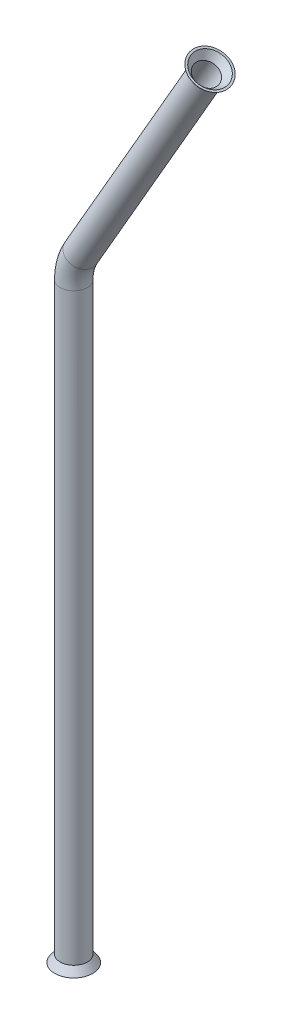
from build123d import *

# Parameters (mm, degrees)
SKETCH1_R           = 4.826
SKETCH1_R_2         = 4.064
SKETCH3_R           = 4.826
BOSS_EXTRUDE1_DEPTH = 2.54
BOSS_EXTRUDE1_DRAFT = -37
SKETCH5_R           = 4.826
BOSS_EXTRUDE2_DEPTH = 2.54
BOSS_EXTRUDE2_DRAFT = -37


with BuildPart() as part:
    # Sweep1: sweep along a path in Sketch2
    with BuildLine(Plane.XY) as sweep1_path:
        Line((0, 0), (0, 206.956941604))
        ThreePointArc((0, 206.956941604), (0.649113009, 211.887444413), (2.552216058, 216.481941604))
        Line((2.552216058, 216.481941604), (47.002216058, 293.4716))
    # Sketch1 → Sweep1 (sweep)
    with BuildSketch(Plane(origin=(0, 0, 0), x_dir=(1, 0, 0), z_dir=(0, 1, 0))):
        Circle(SKETCH1_R)
        Circle(SKETCH1_R_2, mode=Mode.SUBTRACT)
    sweep(path=sweep1_path.line)


with BuildPart() as boss_extrude1_tool:
    # Sketch3 → Boss-Extrude1 (with draft: the straight prism first)
    with BuildSketch(Plane.XZ):
        with Locations(Location((0, 0, 0), (0, 0, 180))):
            Circle(SKETCH3_R)
    extrude(amount=BOSS_EXTRUDE1_DEPTH)
    # Boss-Extrude1: the draft: its side faces are tilted about the plane it starts from
    boss_extrude1_sides = [boss_extrude1_tool.faces().sort_by_distance(p)[0] for p in [
        (4.826, -1.27, 0),
    ]]
    draft(boss_extrude1_sides, Plane.XZ, BOSS_EXTRUDE1_DRAFT)


with BuildPart() as part_1:
    add(part.part)

    # Boss-Extrude1: add boss_extrude1_tool
    add(boss_extrude1_tool.part)

    # Cut-Extrude1 cone 1 section (through the dimple's axis) → Cut-Extrude1 (revolve, cut)
    with BuildSketch(Plane(origin=(0, -2.54, 0), x_dir=(0, 0, -1), z_dir=(1, 0, 0))):
        Polygon((0, 0), (5.978027287, 0), (0, 7.933110155), align=None)
    revolve(axis=Axis((0, -2.54, 0), (0, 1, 0)), mode=Mode.SUBTRACT)


with BuildPart() as boss_extrude2_tool:
    # Sketch5 → Boss-Extrude2 (with draft: the straight prism first)
    with BuildSketch(Plane(origin=(138.827484459, 240.45625657, 0), x_dir=(0, 0, -1), z_dir=(0.5000000000000009, 0.8660254037844383, 0))):
        with Locations(Location((0, 106.03068686, 0), (0, 0, 90))):
            Circle(SKETCH5_R)
    extrude(amount=BOSS_EXTRUDE2_DEPTH)
    # Boss-Extrude2: the draft: its side faces are tilted about the plane it starts from
    boss_extrude2_sides = [boss_extrude2_tool.faces().sort_by_distance(p)[0] for p in [
        (51.816654657, 292.158452263, 0),
    ]]
    draft(boss_extrude2_sides, Plane(origin=(138.827484459, 240.45625657, 0), x_dir=(0, 0, -1), z_dir=(0.5000000000000009, 0.8660254037844383, 0)), BOSS_EXTRUDE2_DRAFT)


with BuildPart() as part_2:
    add(part_1.part)

    # Boss-Extrude2: add boss_extrude2_tool
    add(boss_extrude2_tool.part)

    # Cut-Extrude2 cone 1 section (through the dimple's axis) → Cut-Extrude2 (revolve, cut)
    with BuildSketch(Plane(origin=(48.272216058, 295.671304526, 0), x_dir=(0, 0, 1), z_dir=(0.866025404, -0.5, 0))):
        Polygon((0, 0), (5.978027287, 0), (0, 7.933110155), align=None)
    revolve(axis=Axis((48.272216058, 295.671304526, 0), (-0.5, -0.866025404, 0)), mode=Mode.SUBTRACT)


solid = part_2.part
